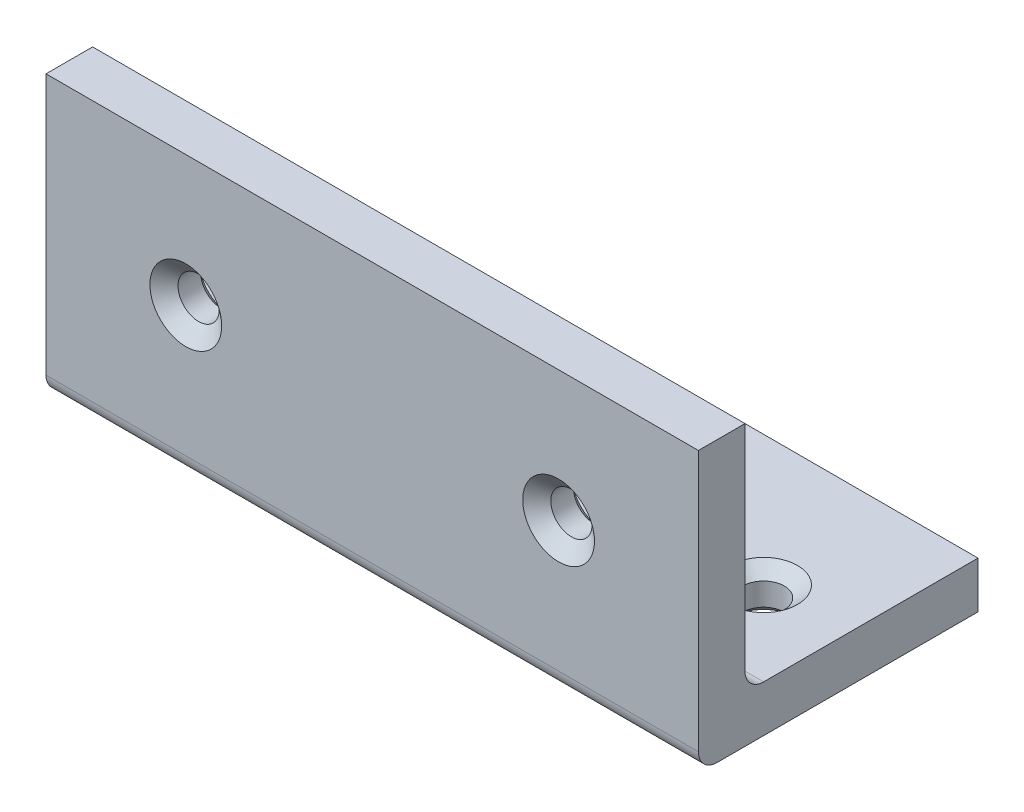
from build123d import *

# Parameters (mm, degrees)
SKETCH1_W           = 88.9
SKETCH1_H           = 38.1
BOSS_EXTRUDE1_DEPTH = 6.35
SKETCH2_W           = 88.9
SKETCH2_H           = 6.35
BOSS_EXTRUDE2_DEPTH = 31.75
FILLET1_R           = 2.54
FILLET2_R           = 2.54


with BuildPart() as part:
    # Sketch1 → Boss-Extrude1 (new body)
    with BuildSketch(Plane(origin=(0, 0, 0), x_dir=(1, 0, 0), z_dir=(0, 1, 0))):
        Rectangle(SKETCH1_W, SKETCH1_H)
    extrude(amount=BOSS_EXTRUDE1_DEPTH)

    # Sketch2 → Boss-Extrude2 (add)
    with BuildSketch(Plane(origin=(0, 6.35, 0), x_dir=(1, 0, 0), z_dir=(0, 1, 0))):
        with Locations((0, -15.875)):
            Rectangle(SKETCH2_W, SKETCH2_H)
    extrude(amount=BOSS_EXTRUDE2_DEPTH)

    # Fillet1
    fillet1_edges = [part.edges().sort_by_distance(p)[0] for p in [
        (0, 6.35, 12.7),
    ]]
    fillet(fillet1_edges, radius=FILLET1_R)

    # Fillet2
    fillet2_edges = [part.edges().sort_by_distance(p)[0] for p in [
        (0, 0, 19.05),
    ]]
    fillet(fillet2_edges, radius=FILLET2_R)

    # Sketch3 → CSK for #10 Flat Head Machine Screw (100)1 (revolve, cut)
    with BuildSketch(Plane(origin=(-25.4, 20.32, 19.05), x_dir=(0, -1, 0), z_dir=(1, 0, 0))):
        Polygon((0, 0), (0, 6.35), (4.6101, 6.35), (2.8067, 4.836767725), (2.8067, 1.747676712), (4.8895, 0), align=None)
    revolve(axis=Axis((-25.4, 20.32, 25.4), (0, 0, -1)), mode=Mode.SUBTRACT)

    # Sketch3 at point 2 (carried to point 2, square into its face) → CSK for _10 Flat Head Machine Screw  2 (revolve, cut)
    with BuildSketch(Plane(origin=(25.4, 20.32, 19.05), x_dir=(0, -1, 0), z_dir=(1, 0, 0))):
        Polygon((0, 0), (0, 6.35), (4.6101, 6.35), (2.8067, 4.836767725), (2.8067, 1.747676712), (4.8895, 0), align=None)
    revolve(axis=Axis((25.4, 20.32, 25.4), (0, 0, -1)), mode=Mode.SUBTRACT)

    # Sketch3 at point 3 (carried to point 3, square into its face) → CSK for _10 Flat Head Machine Screw  3 (revolve, cut)
    with BuildSketch(Plane(origin=(33.02, 0, -1.27), x_dir=(0, 0, -1), z_dir=(1, 0, 0))):
        Polygon((0, 0), (0, 6.35), (4.6101, 6.35), (2.8067, 4.836767725), (2.8067, 1.747676712), (4.8895, 0), align=None)
    revolve(axis=Axis((33.02, -6.35, -1.27), (0, 1, 0)), mode=Mode.SUBTRACT)

    # Sketch3 at point 4 (carried to point 4, square into its face) → CSK for _10 Flat Head Machine Screw  4 (revolve, cut)
    with BuildSketch(Plane(origin=(-33.02, 0, -1.27), x_dir=(0, 0, -1), z_dir=(1, 0, 0))):
        Polygon((0, 0), (0, 6.35), (4.6101, 6.35), (2.8067, 4.836767725), (2.8067, 1.747676712), (4.8895, 0), align=None)
    revolve(axis=Axis((-33.02, -6.35, -1.27), (0, 1, 0)), mode=Mode.SUBTRACT)

    # Sketch3 at point 5 (carried to point 5, square into its face) → CSK for _10 Flat Head Machine Screw  5 (revolve, cut)
    with BuildSketch(Plane(origin=(0, 6.35, -1.27), x_dir=(0, 0, 1), z_dir=(1, 0, 0))):
        Polygon((0, 0), (0, 6.35), (4.6101, 6.35), (2.8067, 4.836767725), (2.8067, 1.747676712), (4.8895, 0), align=None)
    revolve(axis=Axis((0, 12.7, -1.27), (0, -1, 0)), mode=Mode.SUBTRACT)


solid = part.part
